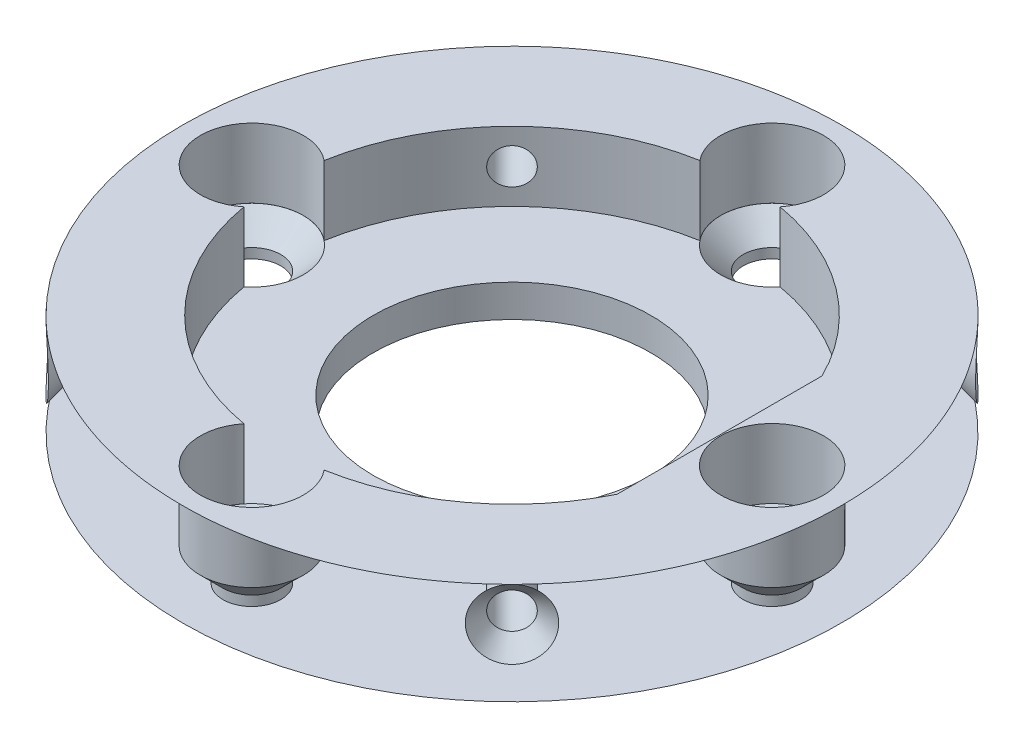
from build123d import *

# Parameters (mm, degrees)
SKETCH_1_R               = 28.5
EXTRUDE_1_DEPTH          = 8.8
SKETCH_2_R               = 4.45
CUT_EXTRUDE_1_DEPTH      = 6
SKETCH_14_R              = 20.02
CUT_EXTRUDE_5_DEPTH      = 6
EXTRUDE_2_DEPTH          = 3
EXTRUDE_2_DEPTH_BACK     = 3
SKETCH_16_W              = 2.07
SKETCH_16_H              = 17.731091336
PATTERN_CIRCULAR_7_COUNT = 4
SKETCH_21_R              = 12
CUT_EXTRUDE_6_DEPTH      = 41.749233276


with BuildPart() as part:
    # 草图1 → 凸台-拉伸1 (new body)
    with BuildSketch(Plane(origin=(0, 0, 0), x_dir=(1, 0, 0), z_dir=(0, 1, 0))):
        Circle(SKETCH_1_R)
    extrude(amount=EXTRUDE_1_DEPTH)

    # 草图2 → 切除-拉伸1 (cut)
    with BuildSketch(Plane(origin=(0, 8.8, 0), x_dir=(1, 0, 0), z_dir=(0, 1, 0))):
        with Locations((-22.5, 0)):
            Circle(SKETCH_2_R)
    cut_extrude_1 = extrude(amount=-CUT_EXTRUDE_1_DEPTH, mode=Mode.SUBTRACT)

    # 草图11 → CSK for _0 Flat Head Machine Screw _100 (revolve, cut)
    with BuildSketch(Plane(origin=(-22.5, 2.8, 0), x_dir=(0, 0, 1), z_dir=(1, 0, 0))):
        Polygon((0, 0), (0, 2.8), (2.499999953, 2.8), (2.499999953, 1.945000047), (4.445, 0), align=None)
    csk_for_0_flat_head_machine_screw_100 = revolve(axis=Axis((-22.5, 9.15, 0), (0, -1, 0)), mode=Mode.SUBTRACT)

    # 草图14 → 切除-拉伸5 (cut)
    with BuildSketch(Plane(origin=(0, 8.8, 0), x_dir=(1, 0, 0), z_dir=(0, 1, 0))):
        Circle(SKETCH_14_R)
    extrude(amount=-CUT_EXTRUDE_5_DEPTH, mode=Mode.SUBTRACT)

    # 草图16 → 凸台-拉伸2 (add, two sides: drawn at the far end of the back side and taken through both)
    with BuildSketch(Plane(origin=(0, 5.8, 0), x_dir=(1, 0, 0), z_dir=(0, 1, 0)).offset(-EXTRUDE_2_DEPTH_BACK)):
        with Locations((18.985, 0)):
            Rectangle(SKETCH_16_W, SKETCH_16_H)
    extrude(amount=EXTRUDE_2_DEPTH + EXTRUDE_2_DEPTH_BACK)

    # 草图19 → CSK for _0 Flat Head Machine Screw _ 2 (revolve, cut)
    with BuildSketch(Plane(origin=(-20.152543264, 5.8, -20.152543264), x_dir=(-0.7071067811865486, 0, 0.7071067811865465), z_dir=(0, 1, 0))):
        Polygon((0, 0), (0, 20.931333928), (1.549999948, 20), (1.549999948, 1.450000021), (2.999999969, 0), align=None)
    csk_for_0_flat_head_machine_screw_2 = revolve(axis=Axis((-24.642671324, 5.8, -24.642671324), (0.7071067811865465, 0, 0.7071067811865486)), mode=Mode.SUBTRACT)

    # 阵列(圆周)7: 切除-拉伸1, CSK for _0 Flat Head Machine Screw _100, CSK for _0 Flat Head Machine Screw _ 2 ×4 about axis
    pattern_circular_7_axis = Axis((0, 8.8, 0), (0, -1, 0))
    add([cut_extrude_1.rotate(pattern_circular_7_axis, i * 360 / PATTERN_CIRCULAR_7_COUNT) for i in range(1, PATTERN_CIRCULAR_7_COUNT)], mode=Mode.SUBTRACT)
    add([csk_for_0_flat_head_machine_screw_100.rotate(pattern_circular_7_axis, i * 360 / PATTERN_CIRCULAR_7_COUNT) for i in range(1, PATTERN_CIRCULAR_7_COUNT)], mode=Mode.SUBTRACT)
    add([csk_for_0_flat_head_machine_screw_2.rotate(pattern_circular_7_axis, i * 360 / PATTERN_CIRCULAR_7_COUNT) for i in range(1, PATTERN_CIRCULAR_7_COUNT)], mode=Mode.SUBTRACT)

    # 草图21 → 切除-拉伸6 (cut, through all)
    with BuildSketch(Plane(origin=(0, 2.8, 0), x_dir=(1, 0, 0), z_dir=(0, 1, 0))):
        Circle(SKETCH_21_R)
    extrude(amount=-CUT_EXTRUDE_6_DEPTH, mode=Mode.SUBTRACT)


solid = part.part
